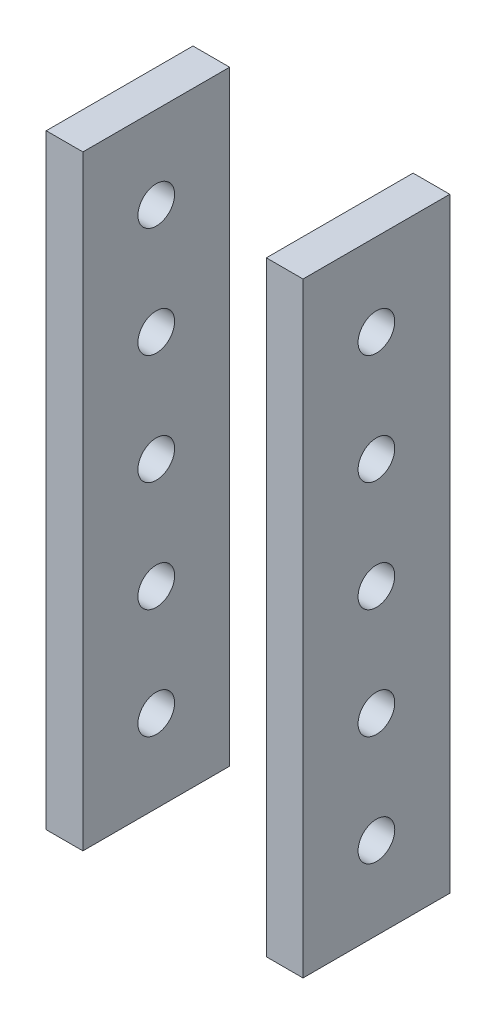
from build123d import *

# Parameters (mm, degrees)
SKETCH2_R           = 5
BOSS_EXTRUDE1_DEPTH = 10


with BuildPart() as part:
    # Sketch2 → Boss-Extrude1 (new body)
    with BuildSketch(Plane(origin=(-25, 0, 0), x_dir=(0, 0, -1), z_dir=(1, 0, 0))):
        Polygon((-40, -141.649794608), (-40, -211.649794608), (-40, -236.649794608), (-40, -306.649794608), (0, -306.649794608), (0, -236.649794608), (0, -141.649794608), align=None)
        with Locations((-20, -284.149794608)):
            Circle(SKETCH2_R, mode=Mode.SUBTRACT)
        with Locations((-20, -254.149794608)):
            Circle(SKETCH2_R, mode=Mode.SUBTRACT)
        with Locations((-20, -224.149794608)):
            Circle(SKETCH2_R, mode=Mode.SUBTRACT)
        with Locations((-20, -194.149794608)):
            Circle(SKETCH2_R, mode=Mode.SUBTRACT)
        with Locations((-20, -164.149794608)):
            Circle(SKETCH2_R, mode=Mode.SUBTRACT)
    extrude(amount=-BOSS_EXTRUDE1_DEPTH)


with BuildPart() as body_2:
    # Mirror2: mirrored copy
    add(part.part.mirror(Plane(origin=(0, 0, 0), x_dir=(0, 0, 1), z_dir=(1, 0, 0))))


solid = Compound([part.part, body_2.part])
